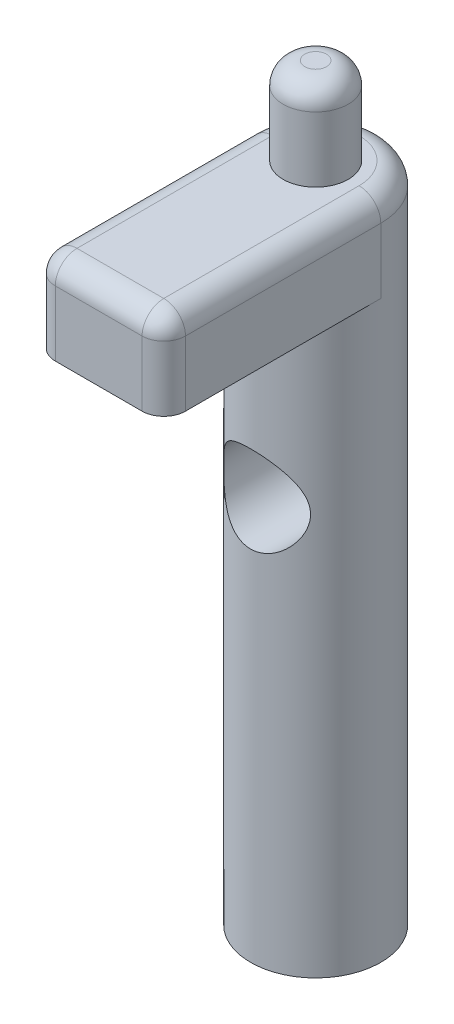
from build123d import *

# Parameters (mm, degrees)
SKETCH2_R               = 3
BOSS_EXTRUDE1_DEPTH     = 25
BOSS_EXTRUDE2_DEPTH     = 4
SKETCH5_R               = 3
BOSS_EXTRUDE3_DEPTH     = 4
FILLET1_R               = 1
CUT_EXTRUDE1_DEPTH      = 4
CUT_EXTRUDE1_DEPTH_BACK = 4
SKETCH6_R               = 2
SKETCH7_R               = 1.5
BOSS_EXTRUDE4_DEPTH     = 4
FILLET2_R               = 1
BOSS_EXTRUDE5_START     = 1.5
SKETCH8_R               = 3
BOSS_EXTRUDE5_DEPTH     = 1.5


with BuildPart() as part:
    # Sketch2 → Boss-Extrude1 (new body)
    with BuildSketch(Plane(origin=(0, 0, 0), x_dir=(1, 0, 0), z_dir=(0, 1, 0))):
        with Locations(Location((0, 0, 0), (0, 0, 270))):
            Circle(SKETCH2_R)
    extrude(amount=BOSS_EXTRUDE1_DEPTH)



with BuildPart() as body_2:
    # Sketch4 → Boss-Extrude2 (new body)
    with BuildSketch(Plane(origin=(0, 25, 0), x_dir=(1, 0, 0), z_dir=(0, 1, 0))):
        with BuildLine():
            Line((-3, 0), (-3, -10))
            Line((-3, -10), (3, -10))
            Line((3, -10), (3, 0))
            ThreePointArc((3, 0), (0, -3), (-3, 0))
        make_face()
    extrude(amount=BOSS_EXTRUDE2_DEPTH)


with BuildPart() as part_1:
    add(part.part)

    add(body_2.part)  # Boss-Extrude3 merges body 2
    # Sketch5 → Boss-Extrude3 (add)
    with BuildSketch(Plane(origin=(0, 25, 0), x_dir=(1, 0, 0), z_dir=(0, 1, 0))):
        Circle(SKETCH5_R)
    extrude(amount=BOSS_EXTRUDE3_DEPTH)

    # Fillet1
    fillet1_edges = [part_1.edges().sort_by_distance(p)[0] for p in [
        (0, 29, -3),
        (3, 27, 10),
        (-3, 27, 10),
        (3, 29, 5),
        (-3, 29, 5),
        (0, 29, 10),
    ]]
    fillet(fillet1_edges, radius=FILLET1_R)

    # Sketch6 → Cut-Extrude1 (cut, two sides: drawn at the far end of the back side and taken through both)
    with BuildSketch(Plane.XY.offset(-CUT_EXTRUDE1_DEPTH_BACK)):
        with Locations(Location((0, 17, 0), (0, 0, 180))):
            Circle(SKETCH6_R)
    extrude(amount=CUT_EXTRUDE1_DEPTH + CUT_EXTRUDE1_DEPTH_BACK, mode=Mode.SUBTRACT)

    # Sketch7 → Boss-Extrude4 (add)
    with BuildSketch(Plane(origin=(0, 29, 0), x_dir=(1, 0, 0), z_dir=(0, 1, 0))):
        with Locations(Location((0, 0, 0), (0, 0, 270))):
            Circle(SKETCH7_R)
    extrude(amount=BOSS_EXTRUDE4_DEPTH)

    # Fillet2
    fillet2_edges = [part_1.edges().sort_by_distance(p)[0] for p in [
        (0, 33, -1.5),
    ]]
    fillet(fillet2_edges, radius=FILLET2_R)

    # Sketch8 → Boss-Extrude5 (add)
    with BuildSketch(Plane(origin=(0, 0, 0), x_dir=(-1, 0, 0), z_dir=(0, -1, 0)).offset(BOSS_EXTRUDE5_START)):
        with Locations(Location((0, 0, 0), (0, 0, 90))):
            Circle(SKETCH8_R)
    extrude(amount=-BOSS_EXTRUDE5_DEPTH)


solid = part_1.part
